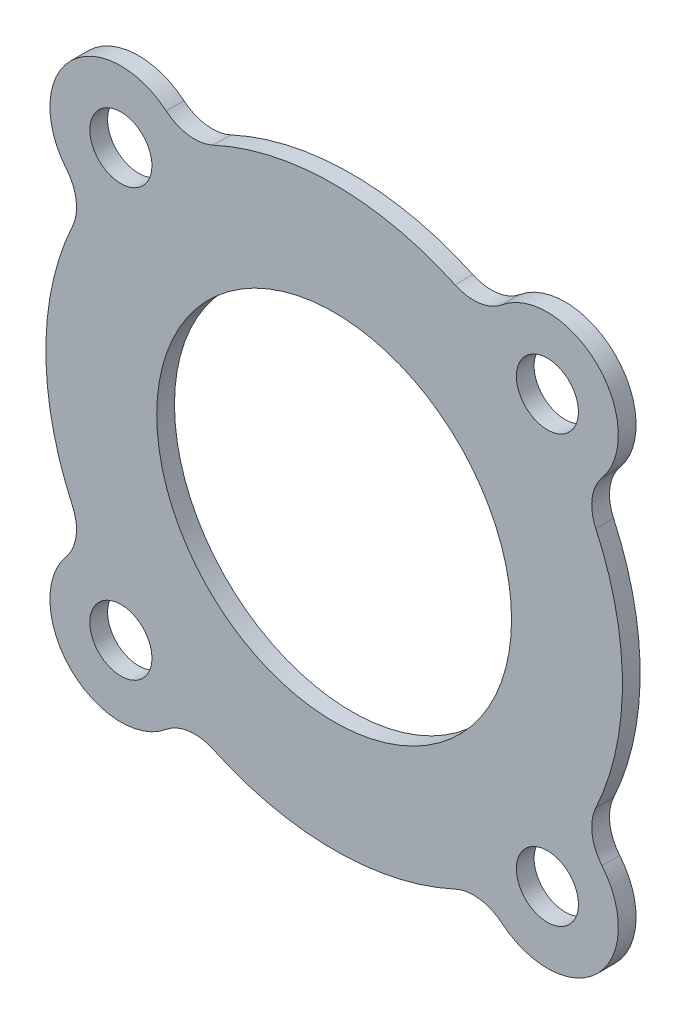
from build123d import *

# Parameters (mm, degrees)
SKETCH_1_R                       = 32.5
SKETCH_1_R_2                     = 20
EXTRUDE_1_DEPTH                  = 2
SKETCH_2_R                       = 8
EXTRUDE_2_DEPTH                  = 2
SKETCH_3_R                       = 3.5
CUT_EXTRUDE_1_DEPTH              = 2
FILLET_1_R                       = 5
PATTERN_CIRCULAR_1_COUNT         = 4
FILLET_1_OF_PATTERN_CIRCULAR_1_R = 5


with BuildPart() as part:
    # 草图1 → 凸台-拉伸1 (new body)
    with BuildSketch(Plane.XY):
        Circle(SKETCH_1_R)
        Circle(SKETCH_1_R_2, mode=Mode.SUBTRACT)
    extrude(amount=EXTRUDE_1_DEPTH)

    # 草图2 → 凸台-拉伸2 (add)
    with BuildSketch(Plane.XY.offset(2)):
        with Locations((24.04163056, 24.04163056)):
            Circle(SKETCH_2_R)
    extrude_2 = extrude(amount=-EXTRUDE_2_DEPTH)

    # 草图3 → 切除-拉伸1 (cut)
    with BuildSketch(Plane.XY.offset(2)):
        with Locations((24.04163056, 24.04163056)):
            Circle(SKETCH_3_R)
    cut_extrude_1 = extrude(amount=-CUT_EXTRUDE_1_DEPTH, mode=Mode.SUBTRACT)

    # 圆角1
    fillet_1_edges = [part.edges().sort_by_distance(p)[0] for p in [
        (16.944361965, 27.733348113, 1),
        (27.733348113, 16.944361965, 1),
    ]]
    fillet(fillet_1_edges, radius=FILLET_1_R)

    # 阵列(圆周)1: 凸台-拉伸2, 切除-拉伸1 ×4 about axis
    pattern_circular_1_axis = Axis((0, 0, 0), (0, 0, 1))
    add([extrude_2.rotate(pattern_circular_1_axis, i * 360 / PATTERN_CIRCULAR_1_COUNT) for i in range(1, PATTERN_CIRCULAR_1_COUNT)])
    add([cut_extrude_1.rotate(pattern_circular_1_axis, i * 360 / PATTERN_CIRCULAR_1_COUNT) for i in range(1, PATTERN_CIRCULAR_1_COUNT)], mode=Mode.SUBTRACT)

    # 圆角1 of 阵列(圆周)1
    fillet_1_of_pattern_circular_1_edges = [part.edges().sort_by_distance(p)[0] for p in [
        (-27.733348113, 16.944361965, 1),
        (-16.944361965, 27.733348113, 1),
        (-16.944361965, -27.733348113, 1),
        (-27.733348113, -16.944361965, 1),
        (27.733348113, -16.944361965, 1),
        (16.944361965, -27.733348113, 1),
    ]]
    fillet(fillet_1_of_pattern_circular_1_edges, radius=FILLET_1_OF_PATTERN_CIRCULAR_1_R)


solid = part.part
